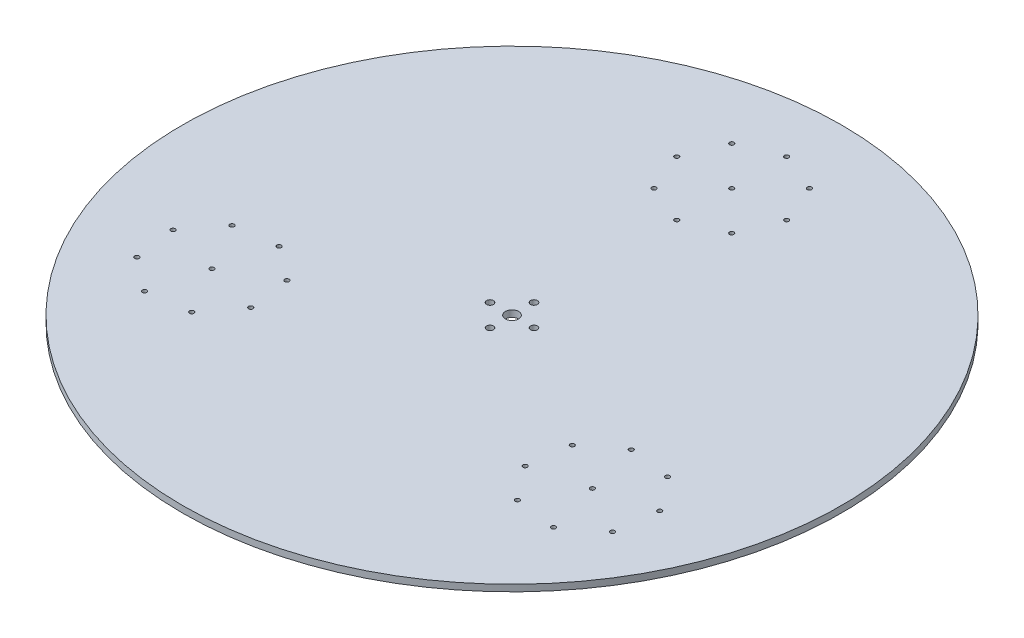
from build123d import *

# Parameters (mm, degrees)
SKETCH_1_R      = 150
SKETCH_1_R_2    = 3
SKETCH_1_R_3    = 1.55
SKETCH_1_R_4    = 1
EXTRUDE_1_DEPTH = 3


with BuildPart() as part:
    # 草图1 → 凸台-拉伸1 (new body)
    with BuildSketch(Plane(origin=(0, 0, 0), x_dir=(1, 0, 0), z_dir=(0, 1, 0))):
        with Locations(Location((0, 0, 0), (0, 0, 270))):
            Circle(SKETCH_1_R)
        with Locations(Location((0, 0, 0), (0, 0, 270))):
            Circle(SKETCH_1_R_2, mode=Mode.SUBTRACT)
        with Locations(Location((0, 10, 0), (0, 0, 270))):
            Circle(SKETCH_1_R_3, mode=Mode.SUBTRACT)
        with Locations(Location((10, 0, 0), (0, 0, 270))):
            Circle(SKETCH_1_R_3, mode=Mode.SUBTRACT)
        with Locations(Location((0, -10, 0), (0, 0, 270))):
            Circle(SKETCH_1_R_3, mode=Mode.SUBTRACT)
        with Locations(Location((-10, 0, 0), (0, 0, 270))):
            Circle(SKETCH_1_R_3, mode=Mode.SUBTRACT)
        with Locations(Location((0, 125, 0), (0, 0, 270))):
            Circle(SKETCH_1_R_4, mode=Mode.SUBTRACT)
        with Locations(Location((17.67766953, 117.67766953, 0), (0, 0, 270))):
            Circle(SKETCH_1_R_4, mode=Mode.SUBTRACT)
        with Locations(Location((25, 100, 0), (0, 0, 270))):
            Circle(SKETCH_1_R_4, mode=Mode.SUBTRACT)
        with Locations(Location((17.67766953, 82.32233047, 0), (0, 0, 270))):
            Circle(SKETCH_1_R_4, mode=Mode.SUBTRACT)
        with Locations(Location((0, 75, 0), (0, 0, 270))):
            Circle(SKETCH_1_R_4, mode=Mode.SUBTRACT)
        with Locations(Location((-17.67766953, 82.32233047, 0), (0, 0, 270))):
            Circle(SKETCH_1_R_4, mode=Mode.SUBTRACT)
        with Locations(Location((-25, 100, 0), (0, 0, 270))):
            Circle(SKETCH_1_R_4, mode=Mode.SUBTRACT)
        with Locations(Location((-17.67766953, 117.67766953, 0), (0, 0, 270))):
            Circle(SKETCH_1_R_4, mode=Mode.SUBTRACT)
        with Locations(Location((0, 100, 0), (0, 0, 270))):
            Circle(SKETCH_1_R_4, mode=Mode.SUBTRACT)
        with Locations(Location((110.750686036, -43.529523872, 0), (0, 0, 270))):
            Circle(SKETCH_1_R_4, mode=Mode.SUBTRACT)
        with Locations(Location((108.253175473, -62.5, 0), (0, 0, 270))):
            Circle(SKETCH_1_R_4, mode=Mode.SUBTRACT)
        with Locations(Location((93.073016506, -74.148145657, 0), (0, 0, 270))):
            Circle(SKETCH_1_R_4, mode=Mode.SUBTRACT)
        with Locations(Location((99.102540378, -28.349364905, 0), (0, 0, 270))):
            Circle(SKETCH_1_R_4, mode=Mode.SUBTRACT)
        with Locations(Location((86.602540378, -50, 0), (0, 0, 270))):
            Circle(SKETCH_1_R_4, mode=Mode.SUBTRACT)
        with Locations(Location((80.132064251, -25.851854343, 0), (0, 0, 270))):
            Circle(SKETCH_1_R_4, mode=Mode.SUBTRACT)
        with Locations(Location((64.951905284, -37.5, 0), (0, 0, 270))):
            Circle(SKETCH_1_R_4, mode=Mode.SUBTRACT)
        with Locations(Location((62.454394721, -56.470476128, 0), (0, 0, 270))):
            Circle(SKETCH_1_R_4, mode=Mode.SUBTRACT)
        with Locations(Location((74.102540378, -71.650635095, 0), (0, 0, 270))):
            Circle(SKETCH_1_R_4, mode=Mode.SUBTRACT)
        with Locations(Location((-93.073016506, -74.148145657, 0), (0, 0, 270))):
            Circle(SKETCH_1_R_4, mode=Mode.SUBTRACT)
        with Locations(Location((-108.253175473, -62.5, 0), (0, 0, 270))):
            Circle(SKETCH_1_R_4, mode=Mode.SUBTRACT)
        with Locations(Location((-110.750686036, -43.529523872, 0), (0, 0, 270))):
            Circle(SKETCH_1_R_4, mode=Mode.SUBTRACT)
        with Locations(Location((-74.102540378, -71.650635095, 0), (0, 0, 270))):
            Circle(SKETCH_1_R_4, mode=Mode.SUBTRACT)
        with Locations(Location((-86.602540378, -50, 0), (0, 0, 270))):
            Circle(SKETCH_1_R_4, mode=Mode.SUBTRACT)
        with Locations(Location((-62.454394721, -56.470476128, 0), (0, 0, 270))):
            Circle(SKETCH_1_R_4, mode=Mode.SUBTRACT)
        with Locations(Location((-64.951905284, -37.5, 0), (0, 0, 270))):
            Circle(SKETCH_1_R_4, mode=Mode.SUBTRACT)
        with Locations(Location((-80.132064251, -25.851854343, 0), (0, 0, 270))):
            Circle(SKETCH_1_R_4, mode=Mode.SUBTRACT)
        with Locations(Location((-99.102540378, -28.349364905, 0), (0, 0, 270))):
            Circle(SKETCH_1_R_4, mode=Mode.SUBTRACT)
    extrude(amount=EXTRUDE_1_DEPTH)


solid = part.part
